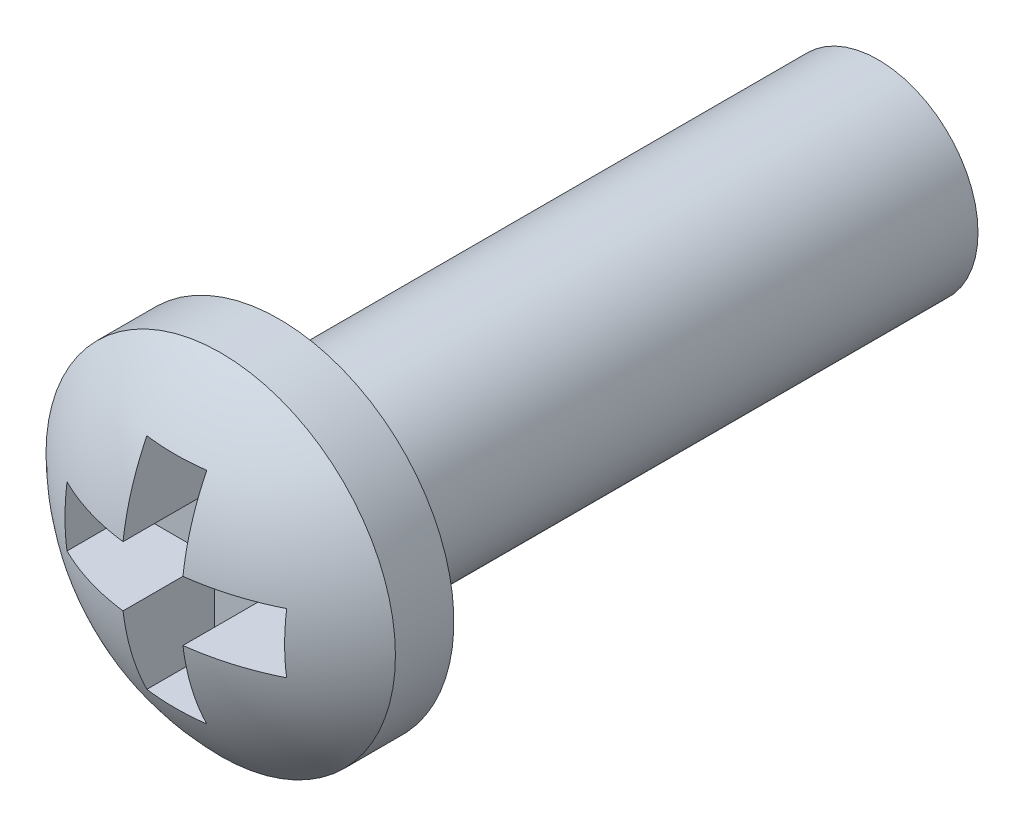
from build123d import *

# Parameters (mm, degrees)
SKETCH_1_R        = 1
EXTRUDE_198_DEPTH = 6
PH1_START         = 1.31
PH1_DEPTH         = 0.96


with BuildPart() as part:
    # 草图1 → Extrude 198 (new body)
    with BuildSketch(Plane.XY):
        Circle(SKETCH_1_R)
    extrude(amount=-EXTRUDE_198_DEPTH)

    # 草图6 → Revolve 324 (revolve)
    with BuildSketch(Plane(origin=(0, 0, 0), x_dir=(1, 0, 0), z_dir=(0, 1, 0)), mode=Mode.PRIVATE) as revolve_324_sk:
        with BuildLine():
            Line((0, 0), (1.75, 0))
            Line((1.75, 0), (1.75, -0.585357107))
            ThreePointArc((1.75, -0.585357107), (0.945147404, -1.114453798), (0, -1.3))
            Line((0, -1.3), (0, 0))
        make_face()
    revolve(revolve_324_sk.sketch.rotate(Axis((0, 0, -2), (0, 0, 1)), 180), axis=Axis((0, 0, -2), (0, 0, 1)))

    # 草图7 → 十字槽_PH1_简化 (cut)
    with BuildSketch(Plane.XY.offset(PH1_START)):
        Polygon((-0.3, -1.1), (0.3, -1.1), (0.3, -0.3), (1.1, -0.3), (1.1, 0.3), (0.3, 0.3), (0.3, 1.1), (-0.3, 1.1), (-0.3, 0.3), (-1.1, 0.3), (-1.1, -0.3), (-0.3, -0.3), align=None)
    extrude(amount=-PH1_DEPTH, mode=Mode.SUBTRACT)


solid = part.part
